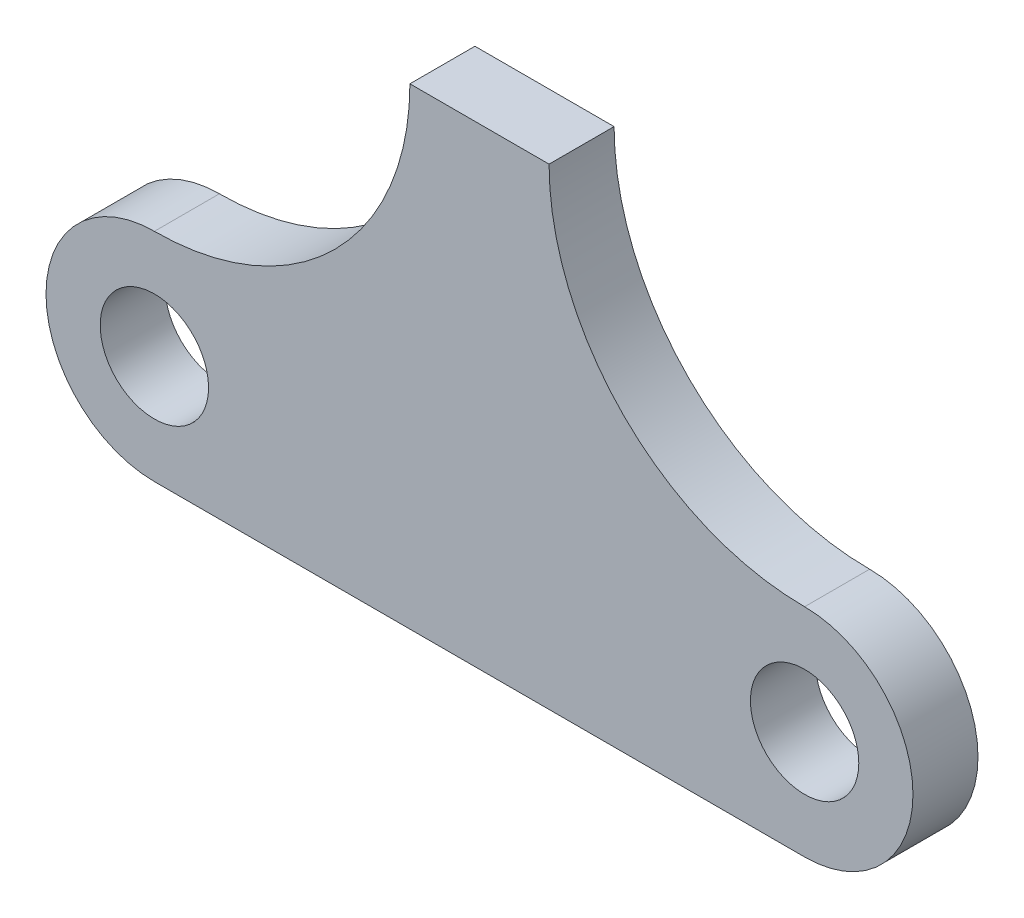
from build123d import *

# Parameters (mm, degrees)
SKETCH1_R           = 2.5
BOSS_EXTRUDE1_DEPTH = 3


with BuildPart() as part:
    # Sketch1 → Boss-Extrude1 (new body)
    with BuildSketch(Plane.XY):
        with BuildLine():
            Line((15, -5), (-15, -5))
            ThreePointArc((-15, -5), (-20, 0), (-15, 5))
            ThreePointArc((-15, 5), (-6.663249624, 8.453195072), (-3.210054553, 16.789945447))
            Line((-3.210054553, 16.789945447), (3.210054553, 16.789945447))
            ThreePointArc((3.210054553, 16.789945447), (6.663249624, 8.453195072), (15, 5))
            ThreePointArc((15, 5), (20, 0), (15, -5))
        make_face()
        with Locations((-15, 0)):
            Circle(SKETCH1_R, mode=Mode.SUBTRACT)
        with Locations((15, 0)):
            Circle(SKETCH1_R, mode=Mode.SUBTRACT)
    extrude(amount=BOSS_EXTRUDE1_DEPTH)


solid = part.part
